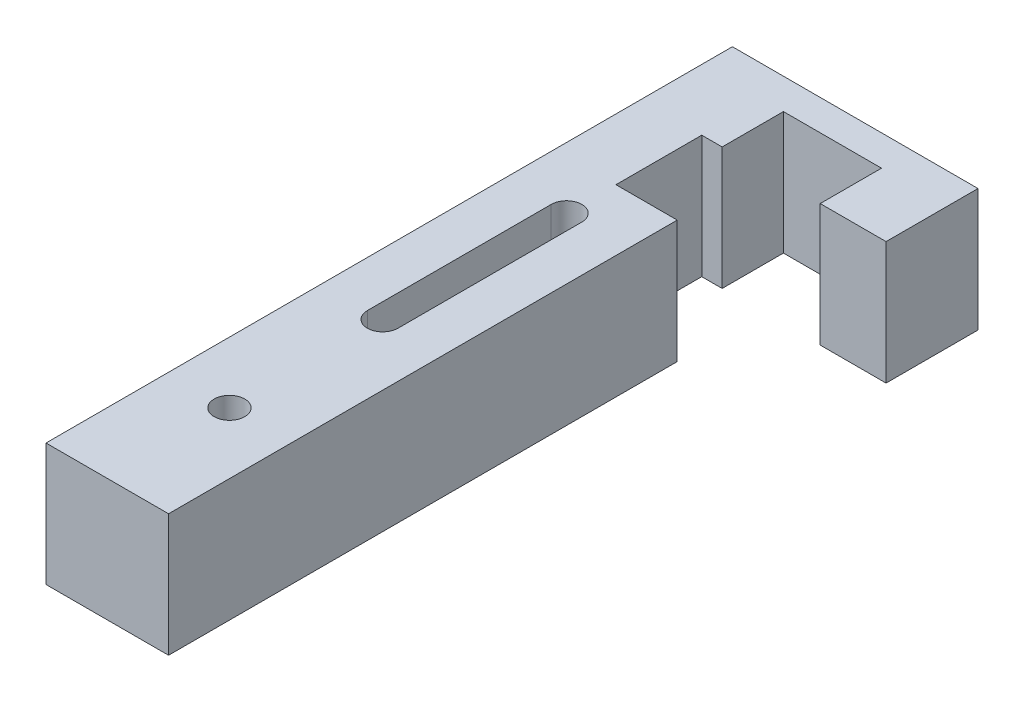
from build123d import *

# Parameters (mm, degrees)
SKETCH1_W           = 25.4
SKETCH1_H           = 101.6
BOSS_EXTRUDE1_DEPTH = 25.4
SKETCH2_R           = 3.175
CUT_EXTRUDE1_DEPTH  = 59.198711326
BOSS_EXTRUDE2_DEPTH = 25.4
SKETCH4_W           = 20.32
SKETCH4_H           = 12.7
CUT_EXTRUDE2_DEPTH  = 152.4


with BuildPart() as part:
    # Sketch1 → Boss-Extrude1 (new body)
    with BuildSketch(Plane(origin=(0, 0, 0), x_dir=(1, 0, 0), z_dir=(0, 1, 0))):
        Rectangle(SKETCH1_W, SKETCH1_H)
    extrude(amount=BOSS_EXTRUDE1_DEPTH)

    # Sketch2 → Cut-Extrude1 (cut, through all)
    with BuildSketch(Plane(origin=(0, 25.4, 0), x_dir=(1, 0, 0), z_dir=(0, 1, 0))):
        with Locations(Location((0, -25.480397296, 0), (0, 0, 270))):
            Circle(SKETCH2_R)
        with BuildLine():
            Line((3.175, 44.369602704), (3.175, 6.269602704))
            ThreePointArc((3.175, 6.269602704), (0, 3.094602704), (-3.175, 6.269602704))
            Line((-3.175, 6.269602704), (-3.175, 44.369602704))
            ThreePointArc((-3.175, 44.369602704), (0, 47.544602704), (3.175, 44.369602704))
        make_face()
    extrude(amount=-CUT_EXTRUDE1_DEPTH, mode=Mode.SUBTRACT)

    # Sketch3 → Boss-Extrude2 (add)
    with BuildSketch(Plane(origin=(0, 0, 0), x_dir=(1, 0, 0), z_dir=(0, 1, 0))):
        Polygon((-12.7, 50.8), (-12.7, 91.44), (38.196727149, 91.44), (38.196727149, 72.39), (0, 72.39), (0, 54.61), (12.7, 54.61), (12.7, 50.8), align=None)
    extrude(amount=BOSS_EXTRUDE2_DEPTH)

    # Sketch4 → Cut-Extrude2 (cut)
    with BuildSketch(Plane(origin=(0, 25.4, 0), x_dir=(1, 0, 0), z_dir=(0, 1, 0))):
        with Locations((14.387739516, 78.74)):
            Rectangle(SKETCH4_W, SKETCH4_H)
    extrude(amount=-CUT_EXTRUDE2_DEPTH, mode=Mode.SUBTRACT)


solid = part.part
